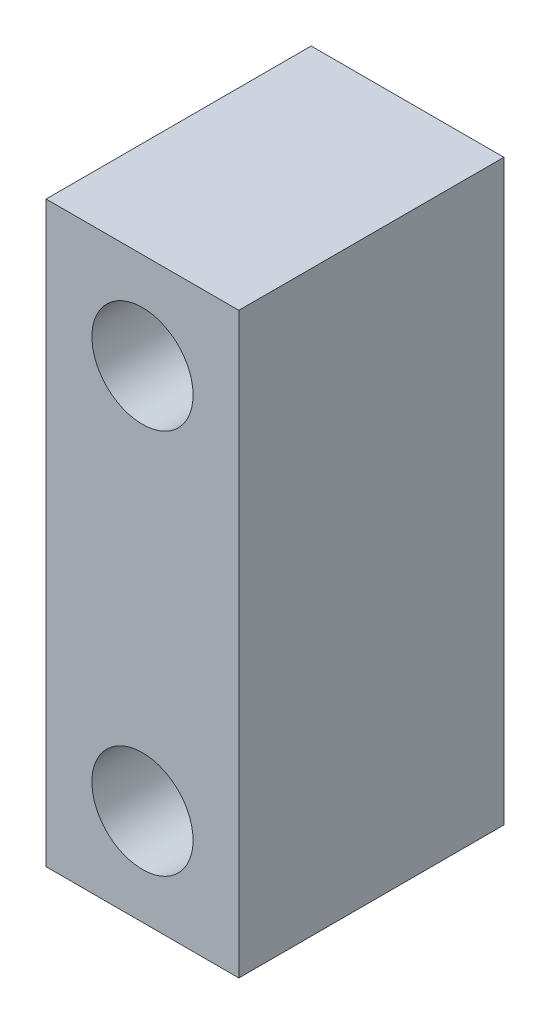
from build123d import *

# Parameters (mm, degrees)
SKETCH_1_W          = 4
SKETCH_1_H          = 12
EXTRUDE_1_DEPTH     = 5.5
SKETCH_2_R          = 1.05
CUT_EXTRUDE_1_DEPTH = 9.381527307


with BuildPart() as part:
    # ｽｹｯﾁ1 → ﾎﾞｽ - 押し出し1 (new body)
    with BuildSketch(Plane.XY):
        Rectangle(SKETCH_1_W, SKETCH_1_H)
    extrude(amount=EXTRUDE_1_DEPTH)

    # ｽｹｯﾁ2 → ｶｯﾄ - 押し出し1 (cut, through all)
    with BuildSketch(Plane.XY.offset(5.5)):
        with Locations((0, 4)):
            Circle(SKETCH_2_R)
        with Locations((0, -4)):
            Circle(SKETCH_2_R)
    extrude(amount=-CUT_EXTRUDE_1_DEPTH, mode=Mode.SUBTRACT)


solid = part.part
